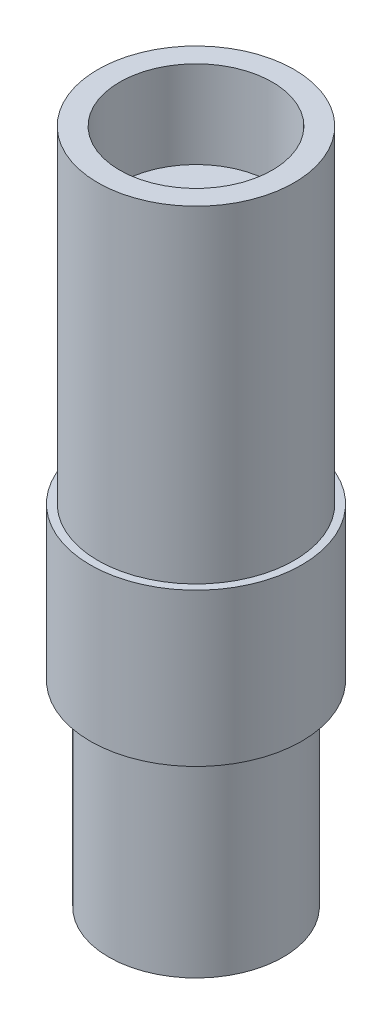
from build123d import *

# Parameters (mm, degrees)
SKETCH1_R                          = 4.5
BOSS_EXTRUDE1_DEPTH                = 15
F_6_0MM_DOWEL_HOLE1_D              = 7
F_6_0MM_DOWEL_HOLE1_DEPTH          = 4
SKETCH5_R                          = 4.85
BOSS_EXTRUDE2_DEPTH                = 7
SKETCH6_R                          = 4
BOSS_EXTRUDE3_DEPTH                = 9
F_6_0MM_DOWEL_HOLE2_D              = 6
F_6_0MM_DOWEL_HOLE2_DEPTH          = 15
TAP_DRILL_FOR_M1_6X0_35_TAP3_D     = 1.25
TAP_DRILL_FOR_M1_6X0_35_TAP3_DEPTH = 41


with BuildPart() as part:
    # Sketch1 → Boss-Extrude1 (new body)
    with BuildSketch(Plane(origin=(0, 0, 0), x_dir=(1, 0, 0), z_dir=(0, 1, 0))):
        with Locations(Location((0, 0, 0), (0, 0, 270))):
            Circle(SKETCH1_R)
    extrude(amount=BOSS_EXTRUDE1_DEPTH)

    # Ø6.0mm Dowel Hole1
    with Locations(Plane(origin=(0, 15, 0), x_dir=(1, 0, 0), z_dir=(0, 1, 0))):
        with Locations((0, 0)):
            Hole(F_6_0MM_DOWEL_HOLE1_D / 2, depth=F_6_0MM_DOWEL_HOLE1_DEPTH)

    # Sketch5 → Boss-Extrude2 (add)
    with BuildSketch(Plane(origin=(0, 0, 0), x_dir=(1, 0, 0), z_dir=(0, 1, 0))):
        with Locations(Location((0, 0, 0), (0, 0, 270))):
            Circle(SKETCH5_R)
    extrude(amount=-BOSS_EXTRUDE2_DEPTH)

    # Sketch6 → Boss-Extrude3 (add)
    with BuildSketch(Plane.XZ.offset(7)):
        with Locations(Location((0, 0, 0), (0, 0, 90))):
            Circle(SKETCH6_R)
    extrude(amount=BOSS_EXTRUDE3_DEPTH)

    # Ø6.0mm Dowel Hole2
    with Locations(Plane(origin=(0, -16, 0), x_dir=(-1, 0, 0), z_dir=(0, -1, 0))):
        with Locations((0, 0)):
            Hole(F_6_0MM_DOWEL_HOLE2_D / 2, depth=F_6_0MM_DOWEL_HOLE2_DEPTH)

    # Tap Drill for M1.6x0.35 Tap3
    with Locations(Plane(origin=(0, -1, 0), x_dir=(-1, 0, 0), z_dir=(0, -1, 0))):
        with Locations((1.75, 0), (-1.75, 0)):
            Hole(TAP_DRILL_FOR_M1_6X0_35_TAP3_D / 2, depth=TAP_DRILL_FOR_M1_6X0_35_TAP3_DEPTH)


solid = part.part
